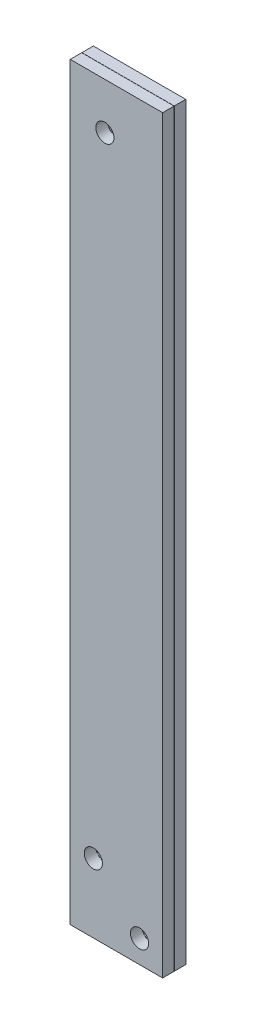
from build123d import *

# Parameters (mm, degrees)
SALIENTE_EXTRUIR1_DEPTH = 6.31
CROQUIS3_W              = 6.31
CROQUIS3_H              = 412.09566061
SALIENTE_EXTRUIR2_DEPTH = 50.8
CROQUIS4_R              = 5
CORTAR_EXTRUIR1_DEPTH   = 31
CROQUIS5_R              = 5
CORTAR_EXTRUIR2_DEPTH   = 35


with BuildPart() as part:
    # Croquis2 → Saliente-Extruir1 (new body)
    with BuildSketch(Plane.XY):
        Polygon((0, 0), (50.8, 0), (50.8, -361.29566061), (50.8, -412.09566061), (0, -412.09566061), align=None)
    extrude(amount=SALIENTE_EXTRUIR1_DEPTH)


with BuildPart() as body_2:
    # Croquis3 → Saliente-Extruir2 (new body)
    with BuildSketch(Plane(origin=(50.8, 0, 0), x_dir=(0, 0, -1), z_dir=(1, 0, 0))):
        with Locations((-9.565, -206.047830305)):
            Rectangle(CROQUIS3_W, CROQUIS3_H)
    extrude(amount=-SALIENTE_EXTRUIR2_DEPTH)


with BuildPart() as cortar_extruir1_tool:
    # Croquis4 → Cortar-Extruir1 (new body)
    with BuildSketch(Plane.XY.offset(12.72)):
        with Locations((19.04, -25.4)):
            Circle(CROQUIS4_R)
    extrude(amount=-CORTAR_EXTRUIR1_DEPTH)


with BuildPart() as part_1:
    add(part.part)

    # Cortar-Extruir1: cut by cortar_extruir1_tool
    add(cortar_extruir1_tool.part, mode=Mode.SUBTRACT)


with BuildPart() as body_2_1:
    add(body_2.part)

    # Cortar-Extruir1: cut by cortar_extruir1_tool
    add(cortar_extruir1_tool.part, mode=Mode.SUBTRACT)


with BuildPart() as cortar_extruir2_tool:
    # Croquis5 → Cortar-Extruir2 (new body)
    with BuildSketch(Plane.XY.offset(12.72)):
        with Locations((12.7, -374.162201783)):
            Circle(CROQUIS5_R)
        with Locations((38.1, -399.562201783)):
            Circle(CROQUIS5_R)
    extrude(amount=-CORTAR_EXTRUIR2_DEPTH)


with BuildPart() as part_2:
    add(part_1.part)

    # Cortar-Extruir2: cut by cortar_extruir2_tool
    add(cortar_extruir2_tool.part, mode=Mode.SUBTRACT)


with BuildPart() as body_2_2:
    add(body_2_1.part)

    # Cortar-Extruir2: cut by cortar_extruir2_tool
    add(cortar_extruir2_tool.part, mode=Mode.SUBTRACT)


solid = Compound([part_2.part, body_2_2.part])
